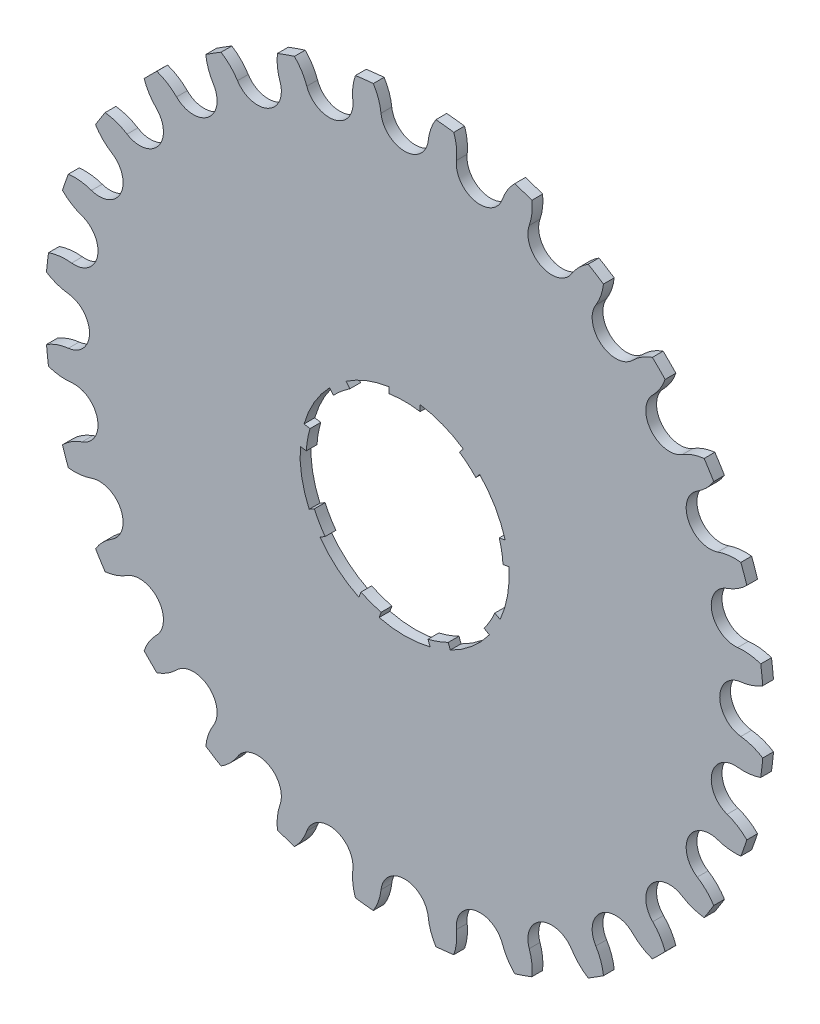
from build123d import *

# Parameters (mm, degrees)
SK_DISCO_R           = 60.167808766
DISCO_DEPTH          = 1.8
HUECO_DIENTE_DEPTH   = 86.109167681
MATRIZ_DIENTES_COUNT = 28


with BuildPart() as part:
    # Sk_Disco → Disco (new body)
    with BuildSketch(Plane.XY):
        Circle(SK_DISCO_R)
        with BuildLine():
            Line((2.6, 17.305779381), (2.6, 16.293863876))
            ThreePointArc((2.6, 16.293863876), (0, 16.5), (-2.6, 16.293863876))
            Line((-2.6, 16.293863876), (-2.6, 17.305779381))
            ThreePointArc((-2.6, 17.305779381), (-6.362648192, 16.302352836), (-9.810241185, 14.491693065))
            Line((-9.810241185, 14.491693065), (-9.163816615, 13.721314261))
            ThreePointArc((-9.163816615, 13.721314261), (-10.60599556, 12.639733311), (-11.92157661, 11.407278866))
            Line((-11.92157661, 11.407278866), (-12.56800118, 12.17765767))
            ThreePointArc((-12.56800118, 12.17765767), (-15.155444566, 8.75), (-16.830161491, 4.795379462))
            Line((-16.830161491, 4.795379462), (-15.839781591, 4.620748764))
            ThreePointArc((-15.839781591, 4.620748764), (-16.249327925, 2.865194932), (-16.464915031, 1.075440854))
            Line((-16.464915031, 1.075440854), (-17.455294931, 1.250071551))
            ThreePointArc((-17.455294931, 1.250071551), (-17.234135678, -3.038843109), (-15.975062189, -7.144745486))
            Line((-15.975062189, -7.144745486), (-15.104136721, -6.641916433))
            ThreePointArc((-15.104136721, -6.641916433), (-14.289419162, -8.25), (-13.304136721, -9.759607887))
            Line((-13.304136721, -9.759607887), (-14.175062189, -10.26243694))
            ThreePointArc((-14.175062189, -10.26243694), (-11.24878317, -13.405777755), (-7.645053746, -15.741764616))
            Line((-7.645053746, -15.741764616), (-7.301098416, -14.796755115))
            ThreePointArc((-7.301098416, -14.796755115), (-5.643332365, -15.504928243), (-3.918204981, -16.028027631))
            Line((-3.918204981, -16.028027631), (-4.262160311, -16.973037132))
            ThreePointArc((-4.262160311, -16.973037132), (0, -17.5), (4.262160311, -16.973037132))
            Line((4.262160311, -16.973037132), (3.918204981, -16.028027631))
            ThreePointArc((3.918204981, -16.028027631), (5.643332365, -15.504928243), (7.301098416, -14.796755115))
            Line((7.301098416, -14.796755115), (7.645053746, -15.741764616))
            ThreePointArc((7.645053746, -15.741764616), (11.24878317, -13.405777755), (14.175062189, -10.26243694))
            Line((14.175062189, -10.26243694), (13.304136721, -9.759607887))
            ThreePointArc((13.304136721, -9.759607887), (14.289419162, -8.25), (15.104136721, -6.641916433))
            Line((15.104136721, -6.641916433), (15.975062189, -7.144745486))
            ThreePointArc((15.975062189, -7.144745486), (17.234135678, -3.038843109), (17.455294931, 1.250071551))
            Line((17.455294931, 1.250071551), (16.464915031, 1.075440854))
            ThreePointArc((16.464915031, 1.075440854), (16.249327925, 2.865194932), (15.839781591, 4.620748764))
            Line((15.839781591, 4.620748764), (16.830161491, 4.795379462))
            ThreePointArc((16.830161491, 4.795379462), (15.155444566, 8.75), (12.56800118, 12.17765767))
            Line((12.56800118, 12.17765767), (11.92157661, 11.407278866))
            ThreePointArc((11.92157661, 11.407278866), (10.60599556, 12.639733311), (9.163816615, 13.721314261))
            Line((9.163816615, 13.721314261), (9.810241185, 14.491693065))
            ThreePointArc((9.810241185, 14.491693065), (6.362648192, 16.302352836), (2.6, 17.305779381))
        make_face(mode=Mode.SUBTRACT)
    extrude(amount=DISCO_DEPTH)

    # Sk_Hueco → Hueco_diente (cut, through all)
    with BuildSketch(Plane.XY):
        with BuildLine():
            ThreePointArc((-3.950006034, 56.269358324), (0, 52.739417117), (3.950006034, 56.269358324))
            ThreePointArc((3.950006034, 56.269358324), (4.86720246, 59.294655916), (6.802195287, 61.794551427))
            ThreePointArc((6.802195287, 61.794551427), (0, 62.167808766), (-6.802195287, 61.794551427))
            ThreePointArc((-6.802195287, 61.794551427), (-4.86720246, 59.294655916), (-3.950006034, 56.269358324))
        make_face()
    hueco_diente = extrude(amount=HUECO_DIENTE_DEPTH, mode=Mode.SUBTRACT)

    # Matriz_dientes: Hueco_diente ×28 about axis
    matriz_dientes_axis = Axis((0, 0, -0.09), (0, 0, 1))
    for i in range(1, MATRIZ_DIENTES_COUNT):
        add(hueco_diente.rotate(matriz_dientes_axis, i * 360 / MATRIZ_DIENTES_COUNT), mode=Mode.SUBTRACT)


solid = part.part
